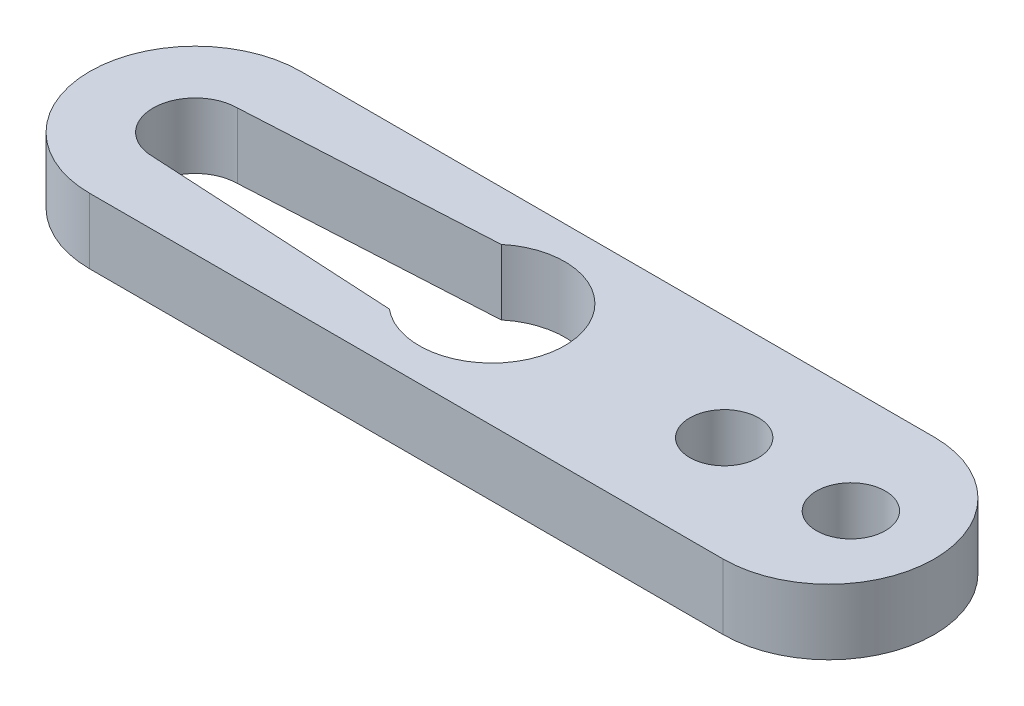
from build123d import *

# Parameters (mm, degrees)
BOSS_EXTRUDE1_DEPTH      = 3
BOSS_EXTRUDE1_DEPTH_BACK = 0.1
F_4_CLEARANCE_HOLE1_D    = 3.2639


with BuildPart() as part:
    # Sketch1 → Boss-Extrude1 (new, two sides: drawn at the far end of the back side and taken through both)
    with BuildSketch(Plane(origin=(0, 0, 0), x_dir=(1, 0, 0), z_dir=(0, 1, 0)).offset(-BOSS_EXTRUDE1_DEPTH_BACK)):
        with BuildLine():
            Line((-15, 5), (15, 5))
            ThreePointArc((15, 5), (20, 0), (15, -5))
            Line((15, -5), (-15, -5))
            ThreePointArc((-15, -5), (-20, 0), (-15, 5))
        make_face()
        with BuildLine():
            Line((-15, 2), (-3.159072307, 2.649999913))
            ThreePointArc((-3.159072307, 2.649999913), (2.5, 0), (-3.159072307, -2.649999913))
            Line((-3.159072307, -2.649999913), (-15, -2))
            ThreePointArc((-15, -2), (-17, 0), (-15, 2))
        make_face(mode=Mode.SUBTRACT)
    extrude(amount=BOSS_EXTRUDE1_DEPTH + BOSS_EXTRUDE1_DEPTH_BACK)

    # #4 Clearance Hole1 (through all)
    with Locations(Plane(origin=(0, 3, 0), x_dir=(1, 0, 0), z_dir=(0, 1, 0))):
        with Locations((10.05, 0), (16.05, 0)):
            Hole(F_4_CLEARANCE_HOLE1_D / 2)


solid = part.part
